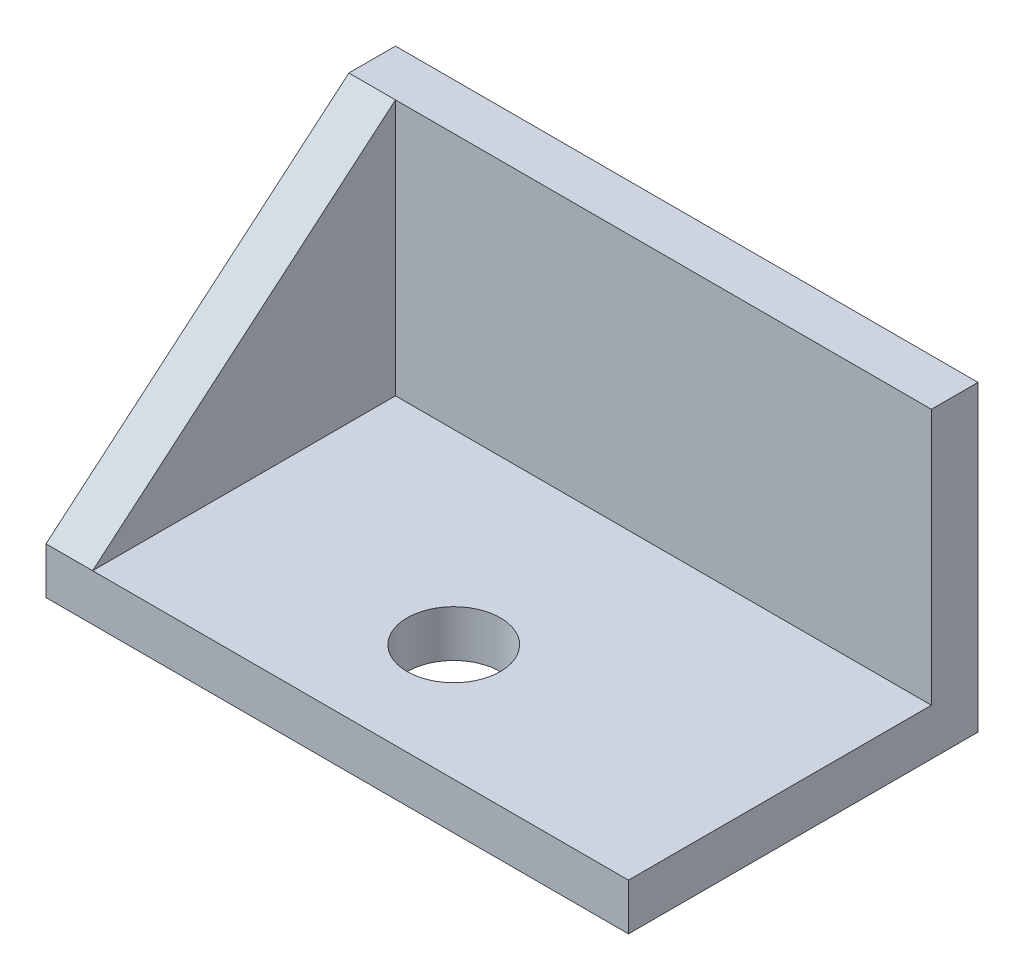
from build123d import *

# Parameters (mm, degrees)
SKETCH1_W           = 115
SKETCH1_H           = 65
SKETCH1_R           = 10
SKETCH1_W_2         = 10
BOSS_EXTRUDE1_DEPTH = 5
BOSS_EXTRUDE2_START = 5
BOSS_EXTRUDE2_DEPTH = 55
BOSS_EXTRUDE3_DEPTH = 10


with BuildPart() as part:
    # Sketch1 → Boss-Extrude1 (new, symmetric)
    # profile 1 of 3: a face of its own
    with BuildSketch(Plane(origin=(0, 0, 0), x_dir=(1, 0, 0), z_dir=(0, 1, 0))):
        with Locations((67.5, -42.5)):
            Rectangle(SKETCH1_W, SKETCH1_H)
        with Locations(Location((62.5, -50, 0), (0, 0, 270))):
            Circle(SKETCH1_R, mode=Mode.SUBTRACT)
    # profile 2 of 3: a face of its own
    with BuildSketch(Plane(origin=(0, 0, 0), x_dir=(1, 0, 0), z_dir=(0, 1, 0))):
        with Locations((5, -42.5)):
            Rectangle(SKETCH1_W_2, SKETCH1_H)
    # profile 3 of 3: a face of its own
    with BuildSketch(Plane(origin=(0, 0, 0), x_dir=(1, 0, 0), z_dir=(0, 1, 0))):
        Polygon((0, 0), (0, -10), (10, -10), (125, -10), (125, 0), align=None)
    extrude(amount=BOSS_EXTRUDE1_DEPTH, both=True)

    # Sketch1<3> → Boss-Extrude2 (add)
    with BuildSketch(Plane(origin=(0, 0, 0), x_dir=(1, 0, 0), z_dir=(0, 1, 0)).offset(BOSS_EXTRUDE2_START)):
        Polygon((0, 0), (0, -10), (10, -10), (125, -10), (125, 0), align=None)
    extrude(amount=BOSS_EXTRUDE2_DEPTH)

    # Sketch2 → Boss-Extrude3 (add)
    with BuildSketch(Plane(origin=(0, 0, 0), x_dir=(0, 0, -1), z_dir=(1, 0, 0))):
        Polygon((-75, 5), (-10, 60), (-10, 5), align=None)
    extrude(amount=BOSS_EXTRUDE3_DEPTH)


solid = part.part
